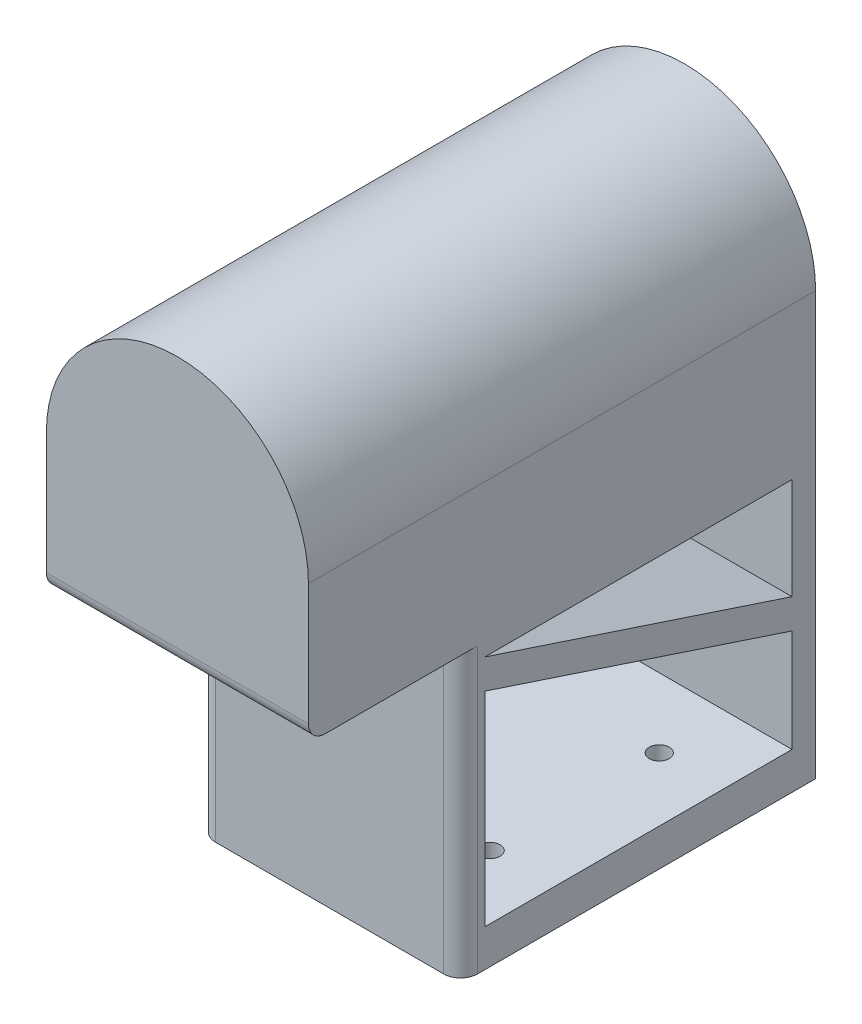
from build123d import *

# Parameters (mm, degrees)
BOSS_EXTRUDE1_DEPTH = 76.2
SKETCH2_R           = 18.288
CUT_EXTRUDE1_DEPTH  = 74.93
SKETCH3_W           = 30.896743612
SKETCH3_H           = 8.166199328
CUT_EXTRUDE2_DEPTH  = 55.372
SKETCH5_W           = 22.86
SKETCH5_H           = 42.694539366
CUT_EXTRUDE4_DEPTH  = 55.372
CUT_EXTRUDE5_DEPTH  = 55.372
SKETCH7_R           = 1.5
CUT_EXTRUDE6_DEPTH  = 7.62
FILLET1_R           = 2.54
FILLET2_R           = 2.54
CUT_EXTRUDE7_DEPTH  = 2.54


with BuildPart() as part:
    # Sketch1 → Boss-Extrude1 (new body)
    with BuildSketch(Plane.XY):
        with BuildLine():
            Line((19.05, 38.034196891), (19.05, -25.465803109))
            Line((19.05, -25.465803109), (-20.32, -25.465803109))
            Line((-20.32, -25.465803109), (-20.32, 38.034196891))
            ThreePointArc((-20.32, 38.034196891), (-0.635, 57.719196891), (19.05, 38.034196891))
        make_face()
    extrude(amount=BOSS_EXTRUDE1_DEPTH)

    # Sketch2 → Cut-Extrude1 (cut)
    with BuildSketch(Plane(origin=(0, 0, 0), x_dir=(-1, 0, 0), z_dir=(0, 0, -1))):
        with Locations((0.635, 38.034196891)):
            Circle(SKETCH2_R)
    extrude(amount=-CUT_EXTRUDE1_DEPTH, mode=Mode.SUBTRACT)

    # Sketch3 → Cut-Extrude2 (cut)
    with BuildSketch(Plane.XZ.offset(25.465803109)):
        with Locations((-0.563393949, 67.607273916)):
            Rectangle(SKETCH3_W, SKETCH3_H)
    extrude(amount=-CUT_EXTRUDE2_DEPTH, mode=Mode.SUBTRACT)

    # Sketch5 → Cut-Extrude4 (cut)
    with BuildSketch(Plane.ZY.offset(20.32)):
        with Locations((64.77, -4.118533426)):
            Rectangle(SKETCH5_W, SKETCH5_H)
    extrude(amount=-CUT_EXTRUDE4_DEPTH, mode=Mode.SUBTRACT)

    # Sketch6 → Cut-Extrude5 (cut)
    with BuildSketch(Plane.ZY.offset(20.32)):
        Polygon((49.692334338, 15.234978865), (3.545926494, 15.234978865), (3.545926494, 0), align=None)
        Polygon((49.692334338, 10.776388735), (3.545926494, -4.45859013), (3.545926494, -19.876418407), (49.692334338, -19.876418407), align=None)
    extrude(amount=-CUT_EXTRUDE5_DEPTH, mode=Mode.SUBTRACT)

    # Sketch7 → Cut-Extrude6 (cut)
    with BuildSketch(Plane(origin=(0, -25.465803109, 0), x_dir=(-1, 0, 0), z_dir=(0, -1, 0))):
        with Locations((10.795, -13.97)):
            Circle(SKETCH7_R)
        with Locations((10.795, -39.37)):
            Circle(SKETCH7_R)
        with Locations((-9.525, -13.97)):
            Circle(SKETCH7_R)
        with Locations((-9.525, -39.37)):
            Circle(SKETCH7_R)
    extrude(amount=-CUT_EXTRUDE6_DEPTH, mode=Mode.SUBTRACT)

    # Fillet1
    fillet1_edges = [part.edges().sort_by_distance(p)[0] for p in [
        (-0.635, 17.228736257, 76.2),
    ]]
    fillet(fillet1_edges, radius=FILLET1_R)

    # Fillet2
    fillet2_edges = [part.edges().sort_by_distance(p)[0] for p in [
        (19.05, -4.118533426, 53.34),
        (-20.32, -4.118533426, 53.34),
    ]]
    fillet(fillet2_edges, radius=FILLET2_R)

    # Sketch8 → Cut-Extrude7 (cut)
    with BuildSketch(Plane.ZY.offset(20.32)):
        Polygon((58.58873891, 27.55033505), (62.707128333, 28.447770947), (58.58873891, 29.345907966), (58.58873891, 29.726617101), (63.65925173, 28.62094803), (63.65925173, 28.273892742), (58.58873891, 27.168924793), align=None)
        with BuildLine():
            add(Edge.make_bspline(
                [(64.996431217, 29.322770947), (65.036672351, 29.321620871), (65.114658498, 29.319392057), (65.227191282, 29.304382374), (65.330482027, 29.277639856), (65.409194262, 29.246710575), (65.46543075, 29.217287823), (65.501792779, 29.194596329), (65.532480318, 29.170293168), (65.558238335, 29.145481874), (65.577165676, 29.118219683), (65.591788765, 29.090652513), (65.600610557, 29.061314813), (65.601668573, 29.041210781), (65.602200448, 29.03110428)],
                knots=[0, 0, 0, 0, 1.990507798, 3.857546318, 5.601569732, 7.256660921, 8.027130436, 8.73909373, 9.372800607, 9.961351037, 10.500235976, 11.006911429, 11.500764338, 12, 12, 12, 12], degree=3))
            add(Edge.make_bspline(
                [(65.602200448, 29.03110428), (65.601668573, 29.02099778), (65.600610557, 29.000893748), (65.591788765, 28.971556048), (65.577165676, 28.943988878), (65.558238335, 28.916726687), (65.532480318, 28.891915393), (65.501792779, 28.867612232), (65.46543075, 28.844920738), (65.409194262, 28.815497986), (65.330482027, 28.784568705), (65.227191282, 28.757826187), (65.114658498, 28.742816503), (65.036672351, 28.74058769), (64.996431217, 28.739437614)],
                knots=[0, 0, 0, 0, 0.499235662, 0.993088571, 1.499764024, 2.038648963, 2.627199393, 3.26090627, 3.972869564, 4.743339079, 6.398430268, 8.142453682, 10.009492202, 12, 12, 12, 12], degree=3))
            add(Edge.make_bspline(
                [(64.996431217, 28.739437614), (64.956190084, 28.74058769), (64.878203937, 28.742816503), (64.765671153, 28.757826187), (64.662380408, 28.784568705), (64.583668173, 28.815497986), (64.527431685, 28.844920738), (64.491069656, 28.867612232), (64.460382117, 28.891915393), (64.4346241, 28.916726687), (64.415696759, 28.943988878), (64.401073669, 28.971556048), (64.392251878, 29.000893748), (64.391193862, 29.02099778), (64.390661987, 29.03110428)],
                knots=[0, 0, 0, 0, 1.990507798, 3.857546318, 5.601569732, 7.256660921, 8.027130436, 8.73909373, 9.372800607, 9.961351037, 10.500235976, 11.006911429, 11.500764338, 12, 12, 12, 12], degree=3))
            add(Edge.make_bspline(
                [(64.390661987, 29.03110428), (64.391186666, 29.040981967), (64.392230692, 29.060636942), (64.401235197, 29.089432768), (64.415680324, 29.116822155), (64.434629148, 29.144078002), (64.460380267, 29.168892275), (64.491071648, 29.193190012), (64.52742486, 29.215902902), (64.583786055, 29.245244148), (64.662185902, 29.277227081), (64.765764853, 29.303386129), (64.878127586, 29.319664025), (64.956175178, 29.321713732), (64.996431217, 29.322770947)],
                knots=[0, 0, 0, 0, 0.488404753, 0.971845354, 1.47922561, 2.018860156, 2.608229279, 3.242817664, 3.955771323, 4.727312586, 6.389026247, 8.135475657, 10.006723338, 12, 12, 12, 12], degree=3))
        make_face()
        with BuildLine():
            add(Edge.make_bspline(
                [(64.996431217, 27.258668383), (65.036672351, 27.257518307), (65.114658498, 27.255289493), (65.227191282, 27.24027981), (65.330482027, 27.213537292), (65.409194262, 27.182608011), (65.46543075, 27.153185259), (65.501792779, 27.130493765), (65.532480318, 27.106190604), (65.558238335, 27.08137931), (65.577165676, 27.054117119), (65.591788765, 27.026549949), (65.600610557, 26.997212248), (65.601668573, 26.977108216), (65.602200448, 26.967001716)],
                knots=[0, 0, 0, 0, 1.990507798, 3.857546318, 5.601569732, 7.256660921, 8.027130436, 8.73909373, 9.372800607, 9.961351037, 10.500235976, 11.006911429, 11.500764338, 12, 12, 12, 12], degree=3))
            add(Edge.make_bspline(
                [(65.602200448, 26.967001716), (65.601675763, 26.957124042), (65.600631725, 26.937469089), (65.59162731, 26.908673091), (65.577181819, 26.881284401), (65.558234499, 26.854025675), (65.532477027, 26.829223563), (65.501812643, 26.804874143), (65.465247899, 26.782328727), (65.409537026, 26.751692384), (65.330402294, 26.721274107), (65.227153238, 26.694597501), (65.114719446, 26.678475837), (65.036682016, 26.676403788), (64.996431217, 26.67533505)],
                knots=[0, 0, 0, 0, 0.48835869, 0.971753697, 1.4790861, 2.018669752, 2.607983289, 3.242511825, 3.955398243, 4.732318271, 6.389555434, 8.135840131, 10.00691133, 12, 12, 12, 12], degree=3))
            add(Edge.make_bspline(
                [(64.996431217, 26.67533505), (64.956180419, 26.676403788), (64.878142989, 26.678475837), (64.765709197, 26.694597501), (64.662460141, 26.721274107), (64.583325409, 26.751692384), (64.527614536, 26.782328727), (64.491049792, 26.804874143), (64.460385408, 26.829223563), (64.434627936, 26.854025675), (64.415680616, 26.881284401), (64.401235125, 26.908673091), (64.39223071, 26.937469089), (64.391186672, 26.957124042), (64.390661987, 26.967001716)],
                knots=[0, 0, 0, 0, 1.99308867, 3.864159869, 5.610444566, 7.267681729, 8.044601757, 8.757488175, 9.392016711, 9.981330248, 10.5209139, 11.028246303, 11.51164131, 12, 12, 12, 12], degree=3))
            add(Edge.make_bspline(
                [(64.390661987, 26.967001716), (64.391193862, 26.977108216), (64.392251878, 26.997212248), (64.401073669, 27.026549949), (64.415696759, 27.054117119), (64.4346241, 27.08137931), (64.460382117, 27.106190604), (64.491069656, 27.130493765), (64.527431685, 27.153185259), (64.583668173, 27.182608011), (64.662380408, 27.213537292), (64.765671153, 27.24027981), (64.878203937, 27.255289493), (64.956190084, 27.257518307), (64.996431217, 27.258668383)],
                knots=[0, 0, 0, 0, 0.499235662, 0.993088571, 1.499764024, 2.038648963, 2.627199393, 3.26090627, 3.972869564, 4.743339079, 6.398430268, 8.142453682, 10.009492202, 12, 12, 12, 12], degree=3))
        make_face()
        with BuildLine():
            Line((67.051559423, 25.733027357), (66.243867115, 25.733027357))
            add(Edge.make_bspline(
                [(66.243867115, 25.733027357), (66.28260692, 25.772843106), (66.360174226, 25.852564736), (66.468966307, 25.97888666), (66.572347001, 26.109648304), (66.67019798, 26.244993717), (66.76091061, 26.385954161), (66.846362199, 26.531412433), (66.924350458, 26.682284456), (66.997421295, 26.836864373), (67.0632652, 26.994582281), (67.120200869, 27.154651777), (67.167701253, 27.316032688), (67.207224728, 27.478605836), (67.238213655, 27.642389926), (67.259589839, 27.807443651), (67.273735474, 27.973564747), (67.275188403, 28.084794525), (67.275918397, 28.140679601)],
                knots=[0, 0, 0, 0, 0.992342649, 1.98693169, 2.976855543, 3.969988518, 4.969517551, 5.970693636, 6.982945216, 8.002815687, 9.02486352, 10.035184142, 11.036656235, 12.029148216, 13.02335152, 14.013108037, 15.001727688, 16, 16, 16, 16], degree=3))
            add(Edge.make_bspline(
                [(67.275918397, 28.140679601), (67.275184901, 28.192343133), (67.27372325, 28.295294032), (67.263801037, 28.44878426), (67.246973124, 28.600860245), (67.222920671, 28.751444462), (67.193020341, 28.901036666), (67.155654129, 29.048791927), (67.112174699, 29.195317294), (67.061617766, 29.339705541), (67.006070574, 29.481699791), (66.944044099, 29.619275823), (66.87721261, 29.752732906), (66.806301921, 29.882246985), (66.729139051, 30.006769884), (66.648009526, 30.127575587), (66.561360678, 30.244023811), (66.499211501, 30.317960149), (66.468226089, 30.354822229)],
                knots=[0, 0, 0, 0, 1.030615892, 2.053727828, 3.066966151, 4.081801417, 5.094889563, 6.109178507, 7.121085909, 8.142879786, 9.160153843, 10.161827701, 11.152208124, 12.13713053, 13.106268419, 14.073498001, 15.03951329, 16, 16, 16, 16], degree=3))
            Line((66.468226089, 30.354822229), (67.186174807, 30.354822229))
            add(Edge.make_bspline(
                [(67.186174807, 30.354822229), (67.216874753, 30.319332363), (67.278313081, 30.248308195), (67.365007427, 30.136608354), (67.444835657, 30.019171184), (67.522194874, 29.898457723), (67.593126071, 29.772205249), (67.660248359, 29.641773165), (67.720879773, 29.505913751), (67.777568925, 29.366424056), (67.828739811, 29.223868209), (67.873051444, 29.079290549), (67.909800157, 28.933390224), (67.941592089, 28.786255648), (67.963633891, 28.637172897), (67.98205547, 28.48695015), (67.991590785, 28.33524909), (67.993106473, 28.233705926), (67.993867115, 28.182746909)],
                knots=[0, 0, 0, 0, 0.951172047, 1.903534998, 2.864157892, 3.828872604, 4.809039982, 5.798517374, 6.801478967, 7.823757442, 8.850242752, 9.870807247, 10.887714424, 11.899576751, 12.920723883, 13.941464303, 14.966932353, 16, 16, 16, 16], degree=3))
            add(Edge.make_bspline(
                [(67.993867115, 28.182746909), (67.993320557, 28.127802038), (67.992230776, 28.018247462), (67.979500696, 27.854750164), (67.960602263, 27.692433158), (67.935061158, 27.530830321), (67.900126876, 27.370310002), (67.859101093, 27.210379802), (67.809895139, 27.051761284), (67.752895083, 26.894698646), (67.689344878, 26.739587526), (67.619078904, 26.586642874), (67.541299534, 26.437089331), (67.456857335, 26.29034603), (67.366560774, 26.146022013), (67.26796876, 26.005539052), (67.163825129, 25.866798877), (67.089134493, 25.777800373), (67.051559423, 25.733027357)],
                knots=[0, 0, 0, 0, 0.983526716, 1.961053866, 2.934201006, 3.908957034, 4.888845537, 5.874284043, 6.864251573, 7.860925746, 8.864846135, 9.864607242, 10.873329523, 11.881739335, 12.895214845, 13.920156785, 14.953680705, 16, 16, 16, 16], degree=3))
        make_face()
    extrude(amount=-CUT_EXTRUDE7_DEPTH, mode=Mode.SUBTRACT)


solid = part.part
